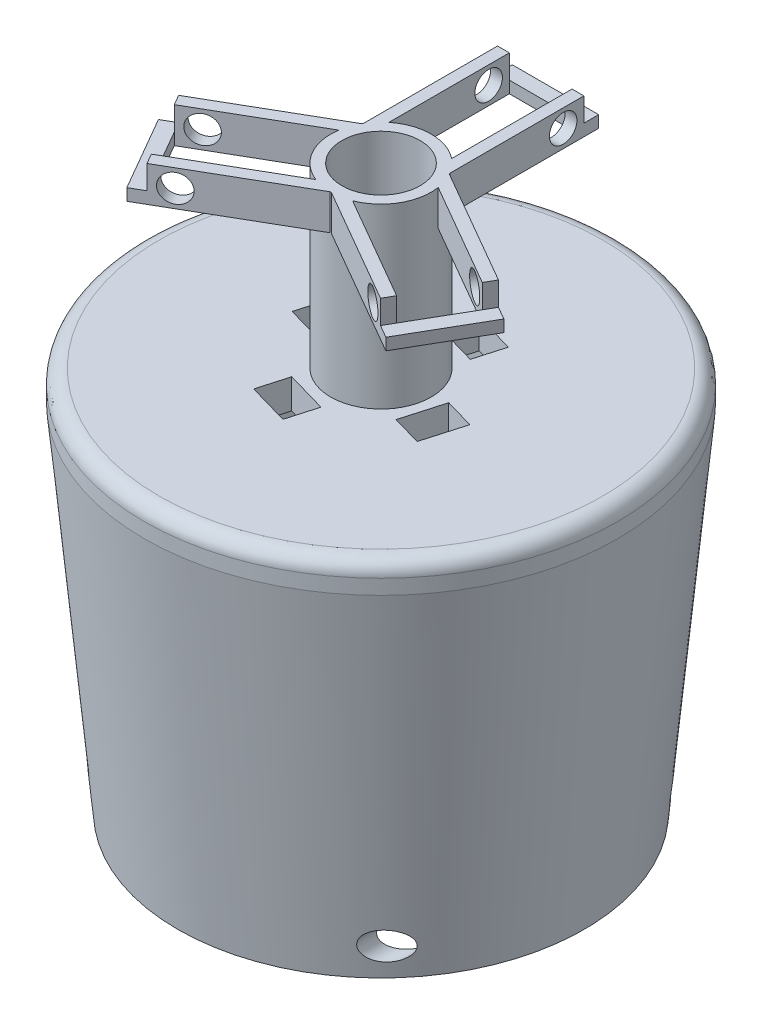
from build123d import *

# Parameters (mm, degrees)
SKETCH3_R                   = 40
SKETCH2_R                   = 32.5
SKETCH22_R                  = 30
SKETCH21_R                  = 37.5
SKETCH24_R                  = 40
CUT_EXTRUDE2_DEPTH          = 20
SKETCH25_R                  = 40
BOSS_EXTRUDE2_DEPTH         = 5
IMPORTANT_ONE_R             = 6.62
CUT_EXTRUDE3_DEPTH          = 5
CIRPATTERN1_COUNT           = 4
CUT_EXTRUDE6_DEPTH          = 103.102889362
CUT_EXTRUDE6_DEPTH_BACK     = 103.102889362
SKETCH32_R                  = 2.5
FILLET1_R                   = 2.5
BOSS_EXTRUDE3_START         = 30
SKETCH33_R                  = 8.5
SKETCH33_R_2                = 6.62
BOSS_EXTRUDE3_DEPTH         = 30
BOSS_EXTRUDE4_DEPTH         = 6
SKETCH35_R                  = 2.33
CUT_EXTRUDE7_DEPTH          = 2
SKETCH36_W                  = 14.6
SKETCH36_H                  = 2
BOSS_EXTRUDE5_DEPTH         = 2.5
CIRPATTERN2_COUNT           = 3
CIRPATTERN2_COPY_1_DEPTH    = 6
CIRPATTERN2_COPY_2_DEPTH    = 6
CIRPATTERN2_COPY_3_SKETCH_R = 2.33
CIRPATTERN2_COPY_3_DEPTH    = 2
CIRPATTERN2_COPY_4_SKETCH_R = 2.33
CIRPATTERN2_COPY_4_DEPTH    = 2
SCALE1_SCALE                = 0.8


with BuildPart() as part:
    # Sketch3 → Loft5 section 0
    with BuildSketch(Plane(origin=(0, 80, 0), x_dir=(1, 0, 0), z_dir=(0, 1, 0))):
        Circle(SKETCH3_R)
    # Sketch2 → Loft5 section 1
    with BuildSketch(Plane(origin=(0, 0, 0), x_dir=(1, 0, 0), z_dir=(0, 1, 0))):
        Circle(SKETCH2_R)
    loft()

    # Sketch22 → Cut-Loft10 section 0
    with BuildSketch(Plane.XZ):
        Circle(SKETCH22_R)
    # Sketch21 → Cut-Loft10 section 1
    with BuildSketch(Plane(origin=(0, 80, 0), x_dir=(1, 0, 0), z_dir=(0, 1, 0))):
        Circle(SKETCH21_R)
    loft(mode=Mode.SUBTRACT)

    # Sketch24 → Cut-Extrude2 (cut)
    with BuildSketch(Plane.XZ):
        Circle(SKETCH24_R)
    extrude(amount=-CUT_EXTRUDE2_DEPTH, mode=Mode.SUBTRACT)

    # Sketch25 → Boss-Extrude2 (add)
    with BuildSketch(Plane(origin=(0, 80, 0), x_dir=(1, 0, 0), z_dir=(0, 1, 0))):
        with Locations(Location((0, 0, 0), (0, 0, 270))):
            Circle(SKETCH25_R)
    extrude(amount=BOSS_EXTRUDE2_DEPTH)

    # IMPORTANT ONE → Cut-Extrude3 (cut)
    with BuildSketch(Plane(origin=(0, 85, 0), x_dir=(1, 0, 0), z_dir=(0, 1, 0))):
        with Locations(Location((0, 0, 0), (0, 0, 270))):
            Circle(IMPORTANT_ONE_R)
        Polygon((-0.650553709, 10.800393564), (6.270986302, 8.817394857), (7.703152035, 13.816284865), (0.781612024, 15.799283572), align=None)
    cut_extrude3 = extrude(amount=-CUT_EXTRUDE3_DEPTH, mode=Mode.SUBTRACT)

    # CirPattern1: Cut-Extrude3 ×4 about axis
    cirpattern1_axis = Axis((0, 0, 0), (0, 1, 0))
    for i in range(1, CIRPATTERN1_COUNT):
        add(cut_extrude3.rotate(cirpattern1_axis, i * 360 / CIRPATTERN1_COUNT), mode=Mode.SUBTRACT)

    # Sketch32 → Cut-Extrude6 (cut, two sides: drawn at the far end of the back side and taken through both)
    with BuildSketch(Plane.XY.offset(-CUT_EXTRUDE6_DEPTH_BACK)):
        with Locations(Location((-25, 25, 0), (0, 0, 221.715798698))):
            Circle(SKETCH32_R)
        with Locations(Location((25, 25, 0), (0, 0, 327.426543512))):
            Circle(SKETCH32_R)
    extrude(amount=CUT_EXTRUDE6_DEPTH + CUT_EXTRUDE6_DEPTH_BACK, mode=Mode.SUBTRACT)

    # Fillet1
    fillet1_edges = [part.edges().sort_by_distance(p)[0] for p in [
        (0, 85, -40),
    ]]
    fillet(fillet1_edges, radius=FILLET1_R)

    # Sketch33 → Boss-Extrude3 (add)
    with BuildSketch(Plane(origin=(0, 85, 0), x_dir=(1, 0, 0), z_dir=(0, 1, 0)).offset(BOSS_EXTRUDE3_START)):
        with Locations(Location((0, 0, 0), (0, 0, 270))):
            Circle(SKETCH33_R)
        with Locations(Location((0, 0, 0), (0, 0, 270))):
            Circle(SKETCH33_R_2, mode=Mode.SUBTRACT)
    extrude(amount=-BOSS_EXTRUDE3_DEPTH)

    # Sketch34 → Boss-Extrude4 (add)
    with BuildSketch(Plane(origin=(0, 115, 0), x_dir=(1, 0, 0), z_dir=(0, 1, 0))):
        with BuildLine():
            Line((5.3, 27), (5.3, 8.5))
            Line((5.3, 8.5), (5.3, 6.64529909))
            ThreePointArc((5.3, 6.64529909), (6.403292887, 5.589976762), (7.3, 4.354308211))
            Line((7.3, 4.354308211), (7.3, 27))
            Line((7.3, 27), (5.3, 27))
        make_face()
    boss_extrude4 = extrude(amount=-BOSS_EXTRUDE4_DEPTH)

    # Sketch35 → Cut-Extrude7 (cut)
    with BuildSketch(Plane(origin=(7.3, 0, 0), x_dir=(0, 0, -1), z_dir=(1, 0, 0))):
        with Locations((23.5, 112)):
            Circle(SKETCH35_R)
    cut_extrude7 = extrude(amount=-CUT_EXTRUDE7_DEPTH, mode=Mode.SUBTRACT)

    # Mirror1: Boss-Extrude4, Cut-Extrude7 across plane
    add(boss_extrude4.mirror(Plane(origin=(0, 0, 0), x_dir=(0, 0, 1), z_dir=(1, 0, 0))))
    add(cut_extrude7.mirror(Plane(origin=(0, 0, 0), x_dir=(0, 0, 1), z_dir=(1, 0, 0))), mode=Mode.SUBTRACT)

    # Sketch36 → Boss-Extrude5 (add)
    with BuildSketch(Plane(origin=(0, 0, -27), x_dir=(-1, 0, 0), z_dir=(0, 0, -1))):
        with Locations((0, 110)):
            Rectangle(SKETCH36_W, SKETCH36_H)
    boss_extrude5 = extrude(amount=BOSS_EXTRUDE5_DEPTH)

    # CirPattern2: Boss-Extrude4, Cut-Extrude7, Boss-Extrude5 ×3 about axis
    cirpattern2_axis = Axis((0, 0, 0), (0, 1, 0))
    add([boss_extrude4.rotate(cirpattern2_axis, i * 360 / CIRPATTERN2_COUNT) for i in range(1, CIRPATTERN2_COUNT)])
    add([cut_extrude7.rotate(cirpattern2_axis, i * 360 / CIRPATTERN2_COUNT) for i in range(1, CIRPATTERN2_COUNT)], mode=Mode.SUBTRACT)
    add([boss_extrude5.rotate(cirpattern2_axis, i * 360 / CIRPATTERN2_COUNT) for i in range(1, CIRPATTERN2_COUNT)])

    # CirPattern2 copy 1 sketch → CirPattern2 copy 1 (add)
    with BuildSketch(Plane(origin=(0, 115, 0), x_dir=(0.4999999999999998, 0, 0.8660254037844387), z_dir=(0, 1, 0))):
        with BuildLine():
            Line((5.3, -27), (5.3, -8.5))
            Line((5.3, -8.5), (5.3, -6.64529909))
            ThreePointArc((5.3, -6.64529909), (6.403292887, -5.589976762), (7.3, -4.354308211))
            Line((7.3, -4.354308211), (7.3, -27))
            Line((7.3, -27), (5.3, -27))
        make_face()
    extrude(amount=-CIRPATTERN2_COPY_1_DEPTH)

    # CirPattern2 copy 2 sketch → CirPattern2 copy 2 (add)
    with BuildSketch(Plane(origin=(0, 115, 0), x_dir=(0.5000000000000004, 0, -0.8660254037844384), z_dir=(0, 1, 0))):
        with BuildLine():
            Line((5.3, -27), (5.3, -8.5))
            Line((5.3, -8.5), (5.3, -6.64529909))
            ThreePointArc((5.3, -6.64529909), (6.403292887, -5.589976762), (7.3, -4.354308211))
            Line((7.3, -4.354308211), (7.3, -27))
            Line((7.3, -27), (5.3, -27))
        make_face()
    extrude(amount=-CIRPATTERN2_COPY_2_DEPTH)

    # CirPattern2 copy 3 sketch → CirPattern2 copy 3 (cut)
    with BuildSketch(Plane(origin=(3.65, 0, 6.321985448), x_dir=(-0.8660254037844388, 0, 0.49999999999999967), z_dir=(0.49999999999999967, 0, 0.8660254037844388))):
        with Locations((23.5, -112)):
            Circle(CIRPATTERN2_COPY_3_SKETCH_R)
    extrude(amount=-CIRPATTERN2_COPY_3_DEPTH, mode=Mode.SUBTRACT)

    # CirPattern2 copy 4 sketch → CirPattern2 copy 4 (cut)
    with BuildSketch(Plane(origin=(3.65, 0, -6.321985448), x_dir=(0.8660254037844383, 0, 0.5000000000000006), z_dir=(0.5000000000000006, 0, -0.8660254037844383))):
        with Locations((23.5, -112)):
            Circle(CIRPATTERN2_COPY_4_SKETCH_R)
    extrude(amount=-CIRPATTERN2_COPY_4_DEPTH, mode=Mode.SUBTRACT)


with BuildPart() as part_1:
    # Scale1: scaled about (4.82e-07, 66.713757397, 4.5e-08)
    add(part.part.scale(SCALE1_SCALE).moved(Location((9.6e-08, 13.342751479, 9e-09))))


solid = part_1.part
